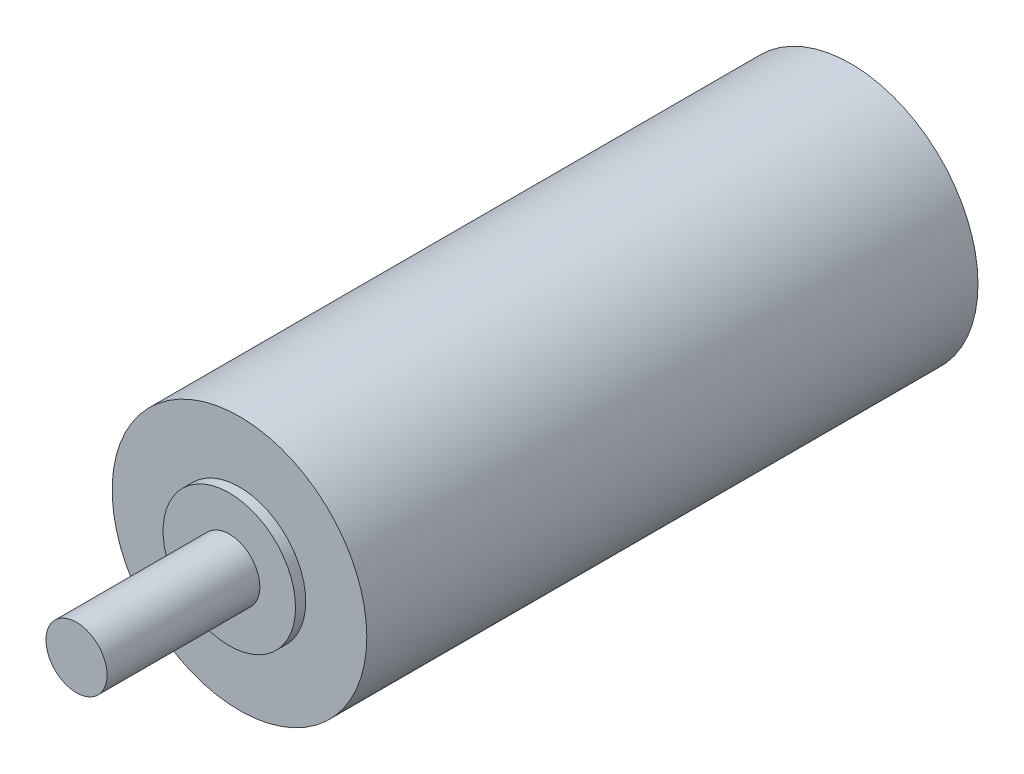
from build123d import *

# Parameters (mm, degrees)
ESBO_O1_R                = 12.5
RESSALTO_EXTRUS_O1_DEPTH = 60
ESBO_O2_R                = 6.5
RESSALTO_EXTRUS_O2_DEPTH = 1
ESBO_O3_R                = 3
RESSALTO_EXTRUS_O3_DEPTH = 15


with BuildPart() as part:
    # Esboço1 → Ressalto-extrusão1 (new body)
    with BuildSketch(Plane.XY):
        Circle(ESBO_O1_R)
    extrude(amount=RESSALTO_EXTRUS_O1_DEPTH)

    # Esboço2 → Ressalto-extrusão2 (add)
    with BuildSketch(Plane.XY.offset(60)):
        Circle(ESBO_O2_R)
    extrude(amount=RESSALTO_EXTRUS_O2_DEPTH)

    # Esboço3 → Ressalto-extrusão3 (add)
    with BuildSketch(Plane.XY.offset(61)):
        Circle(ESBO_O3_R)
    extrude(amount=RESSALTO_EXTRUS_O3_DEPTH)


solid = part.part
